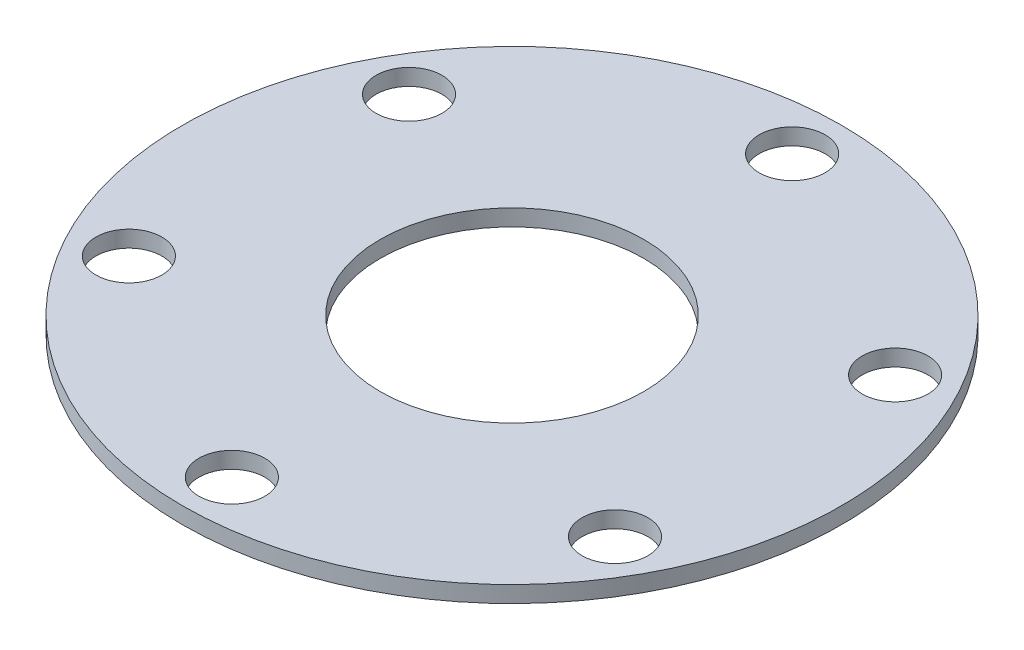
from build123d import *

# Parameters (mm, degrees)
SKETCH1_R           = 127
BOSS_EXTRUDE1_DEPTH = 6.35
SKETCH2_R           = 50.8
CUT_EXTRUDE1_DEPTH  = 6.35
SKETCH4_R           = 12.7
CUT_EXTRUDE4_DEPTH  = 12.7


with BuildPart() as part:
    # Sketch1 → Boss-Extrude1 (new body)
    with BuildSketch(Plane(origin=(0, 0, 0), x_dir=(1, 0, 0), z_dir=(0, 1, 0))):
        with Locations(Location((0, 0, 0), (0, 0, 270))):
            Circle(SKETCH1_R)
    extrude(amount=BOSS_EXTRUDE1_DEPTH)

    # Sketch2 → Cut-Extrude1 (cut)
    with BuildSketch(Plane(origin=(0, 6.35, 0), x_dir=(1, 0, 0), z_dir=(0, 1, 0))):
        with Locations(Location((0, 0, 0), (0, 0, 270))):
            Circle(SKETCH2_R)
    extrude(amount=-CUT_EXTRUDE1_DEPTH, mode=Mode.SUBTRACT)

    # Sketch4 → Cut-Extrude4 (cut)
    with BuildSketch(Plane(origin=(0, 6.35, 0), x_dir=(1, 0, 0), z_dir=(0, 1, 0))):
        with Locations(Location((0, 107.95, 0), (0, 0, 270))):
            Circle(SKETCH4_R)
        with Locations(Location((93.6625, 53.975, 0), (0, 0, 270))):
            Circle(SKETCH4_R)
        with Locations(Location((0, -107.95, 0), (0, 0, 270))):
            Circle(SKETCH4_R)
        with Locations(Location((-93.6625, 53.975, 0), (0, 0, 270))):
            Circle(SKETCH4_R)
        with Locations(Location((-93.6625, -53.975, 0), (0, 0, 270))):
            Circle(SKETCH4_R)
        with Locations(Location((93.6625, -53.975, 0), (0, 0, 270))):
            Circle(SKETCH4_R)
    extrude(amount=-CUT_EXTRUDE4_DEPTH, mode=Mode.SUBTRACT)


solid = part.part
